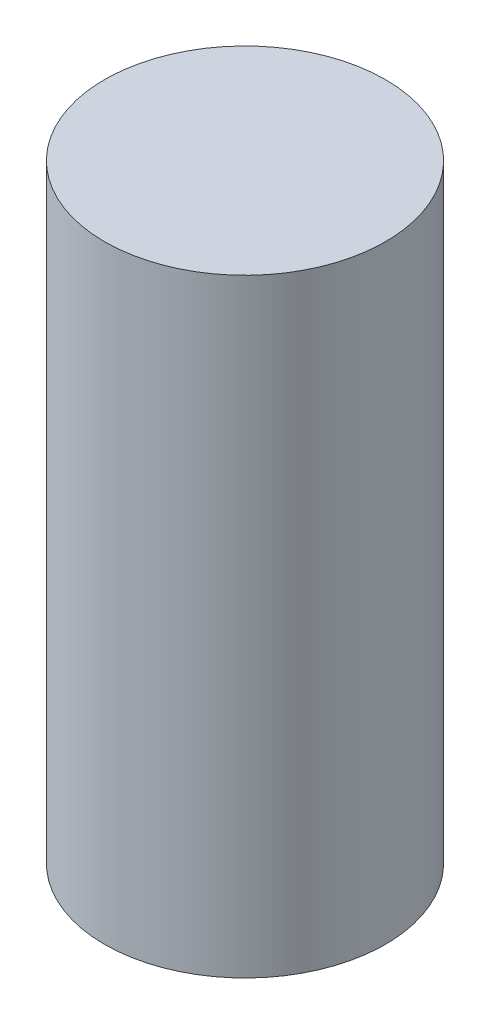
from build123d import *

# Parameters (mm, degrees)
SKETCH1_R           = 45
BOSS_EXTRUDE1_DEPTH = 195


with BuildPart() as part:
    # Sketch1 → Boss-Extrude1 (new body)
    with BuildSketch(Plane(origin=(0, 0, 0), x_dir=(1, 0, 0), z_dir=(0, 1, 0))):
        with Locations(Location((0, 0, 0), (0, 0, 270))):
            Circle(SKETCH1_R)
    extrude(amount=BOSS_EXTRUDE1_DEPTH)


solid = part.part
